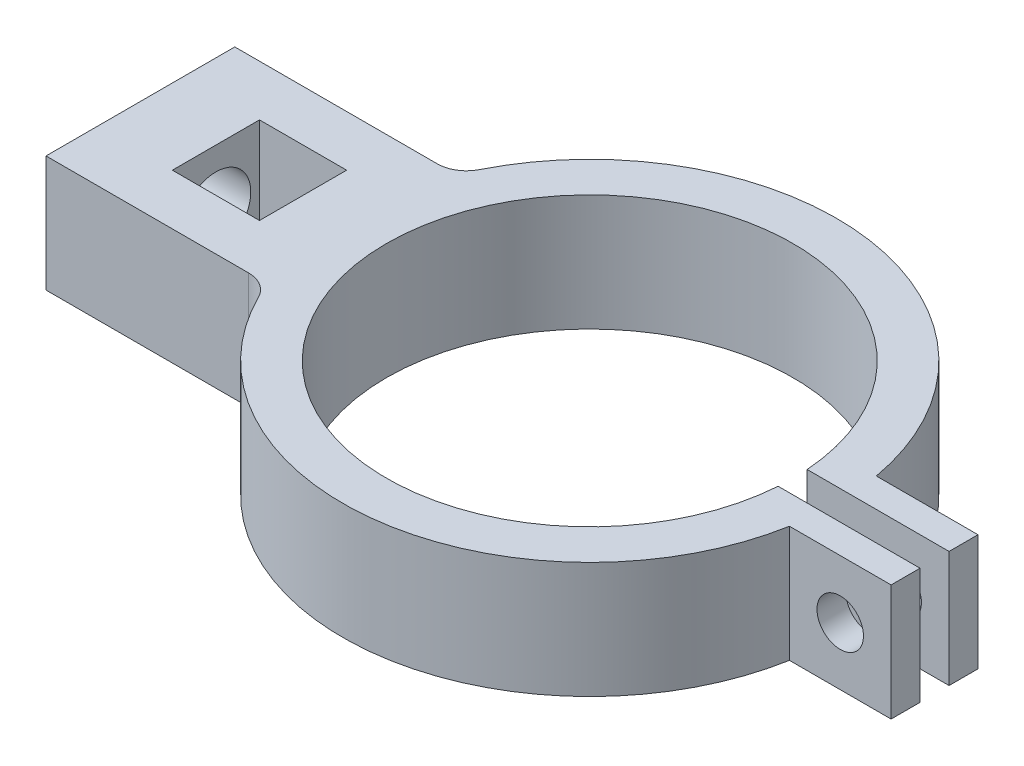
from build123d import *

# Parameters (mm, degrees)
SKETCH1_W           = 7.62
SKETCH1_H           = 7.62
BOSS_EXTRUDE3_DEPTH = 10.16
CUT_EXTRUDE1_REACH  = 49.877
SKETCH5_R           = 2.032
SKETCH6_R           = 3.048
CUT_EXTRUDE2_DEPTH  = 6.604
FILLET1_R           = 2.54


with BuildPart() as part:
    # Sketch1 → Boss-Extrude3 (new body)
    with BuildSketch(Plane(origin=(0, 0, 0), x_dir=(1, 0, 0), z_dir=(0, 1, 0))):
        with BuildLine():
            Line((30.141230573, 3.809632415), (30.141230573, 1.278686529))
            Line((30.141230573, 1.278686529), (17.731545846, 1.278686529))
            ThreePointArc((17.731545846, 1.278686529), (-17.777589304, -0.008709978), (17.732790297, -1.261311079))
            Line((17.732790297, -1.261311079), (30.144338077, -1.261311079))
            Line((30.144338077, -1.261311079), (30.144338077, -3.792256965))
            Line((30.144338077, -3.792256965), (21.254338077, -3.792256965))
            ThreePointArc((21.254338077, -3.792256965), (2.324792651, -21.464469225), (-19.949513152, -8.255))
            Line((-19.949513152, -8.255), (-39.292036048, -8.255))
            Line((-39.292036048, -8.255), (-39.292036048, 8.255))
            Line((-39.292036048, 8.255), (-19.949513152, 8.255))
            ThreePointArc((-19.949513152, 8.255), (2.3160182, 21.465417762), (21.251230573, 3.809632415))
            Line((21.251230573, 3.809632415), (30.141230573, 3.809632415))
        make_face()
        with Locations((-28.878036048, -0.000367585)):
            Rectangle(SKETCH1_W, SKETCH1_H, mode=Mode.SUBTRACT)
    extrude(amount=BOSS_EXTRUDE3_DEPTH)

    # Cut-Extrude1: up to this face of the body (flat: up to its plane)
    cut_extrude1_end = Plane(part.part.faces().sort_by_distance((25.699338077, 5.08, 3.792256965))[0])
    # Sketch5 → Cut-Extrude1 (cut, up to the picked face)
    with BuildSketch(Plane(origin=(0, 0, -3.809632415), x_dir=(-1, 0, 0), z_dir=(0, 0, -1)), mode=Mode.PRIVATE) as cut_extrude1_sk1:
        with Locations((-25.696230573, 5.08)):
            Circle(SKETCH5_R)
    cut_extrude1_tool1 = split(extrude(cut_extrude1_sk1.sketch, amount=-CUT_EXTRUDE1_REACH, mode=Mode.PRIVATE), bisect_by=cut_extrude1_end, keep=Keep.BOTH, mode=Mode.PRIVATE)
    add(cut_extrude1_tool1.solids().sort_by(Axis((25.696231, 5.08, -3.809632), (0, 0, 1)))[0], mode=Mode.SUBTRACT)

    # Sketch6 → Cut-Extrude2 (cut)
    with BuildSketch(Plane.ZY.offset(39.292036048)):
        with Locations((0, 5.08)):
            Circle(SKETCH6_R)
    extrude(amount=-CUT_EXTRUDE2_DEPTH, mode=Mode.SUBTRACT)

    # Fillet1
    fillet1_edges = [part.edges().sort_by_distance(p)[0] for p in [
        (-19.949513152, 5.08, -8.255),
        (-19.949513152, 5.08, 8.255),
    ]]
    fillet(fillet1_edges, radius=FILLET1_R)


solid = part.part
